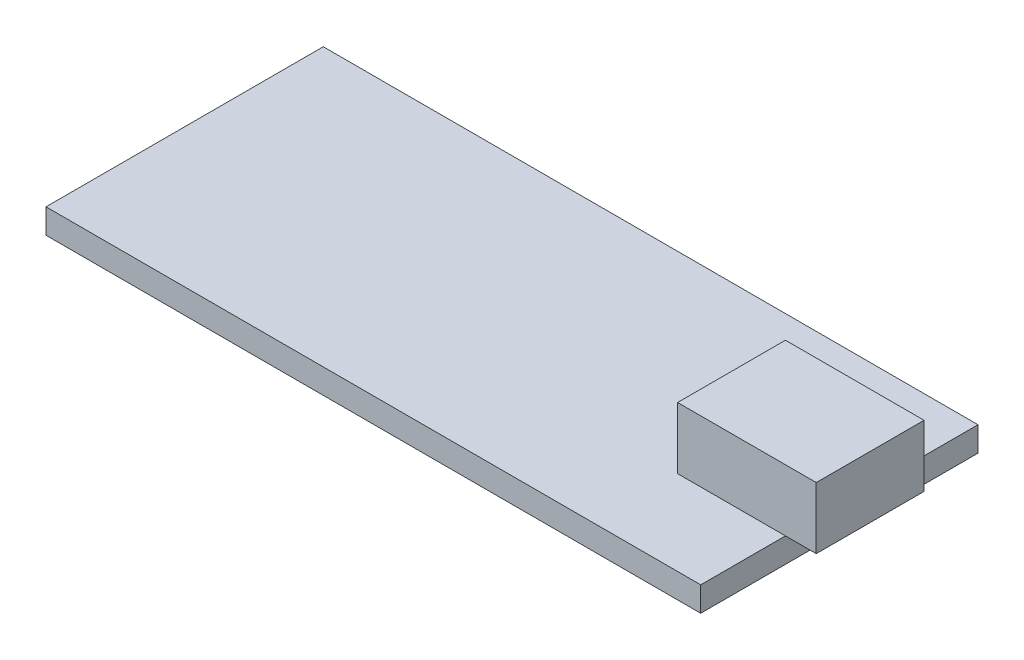
from build123d import *

# Parameters (mm, degrees)
ESBO_O1_W                = 42.5
ESBO_O1_H                = 18
RESSALTO_EXTRUS_O1_DEPTH = 1.6
RESSALTO_EXTRUS_O2_DEPTH = 4


with BuildPart() as part:
    # Esboço1 → Ressalto-extrusão1 (new body)
    with BuildSketch(Plane(origin=(0, 0, 0), x_dir=(1, 0, 0), z_dir=(0, 1, 0))):
        Rectangle(ESBO_O1_W, ESBO_O1_H)
    extrude(amount=-RESSALTO_EXTRUS_O1_DEPTH)

    # Esboço2 → Ressalto-extrusão2 (add)
    with BuildSketch(Plane(origin=(0, 0, 0), x_dir=(1, 0, 0), z_dir=(0, 1, 0))):
        Polygon((21.25, 3.5), (23.25, 3.5), (23.25, -3.5), (21.25, -3.5), (14.25, -3.5), (14.25, 3.5), align=None)
    extrude(amount=RESSALTO_EXTRUS_O2_DEPTH)


solid = part.part
